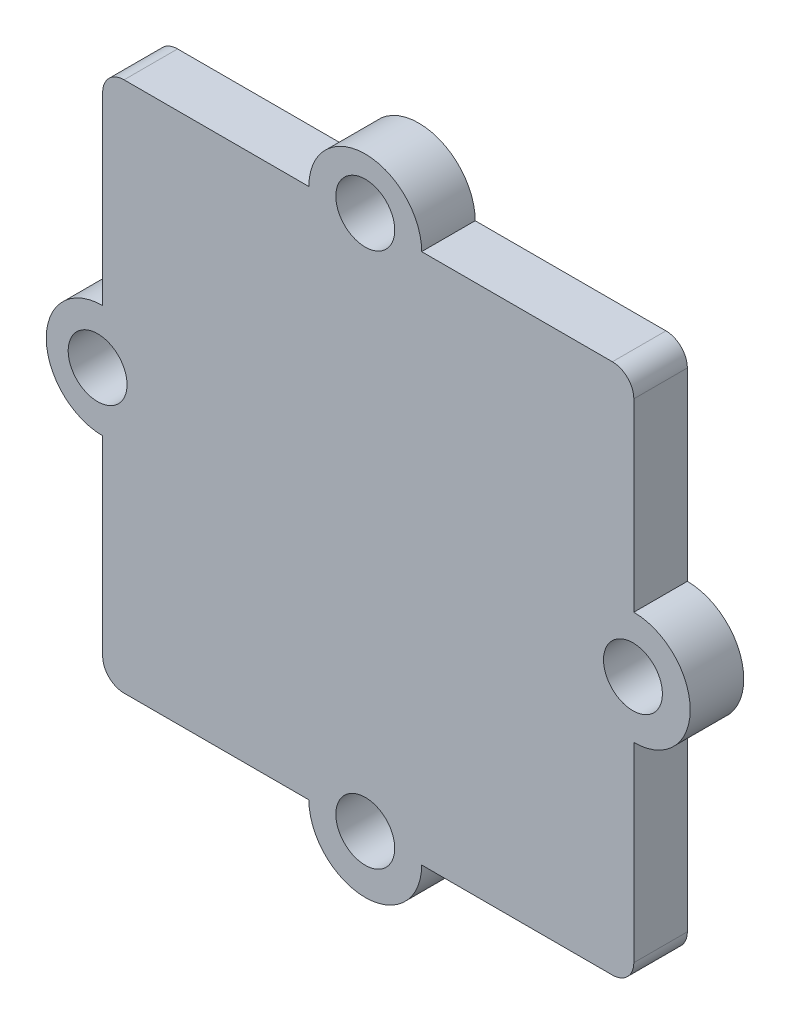
from build123d import *

# Parameters (mm, degrees)
BOSS_EXTRUDE1_DEPTH   = 2
F_1_CLEARANCE_HOLE1_D = 2.20000068
FILLET1_R             = 0.8


with BuildPart() as part:
    # Sketch1 → Boss-Extrude1 (new body)
    with BuildSketch(Plane(origin=(0, 0, -2), x_dir=(-1, 0, 0), z_dir=(0, 0, -1))):
        with BuildLine():
            Line((-1.91693771, 8.900326187), (-9.84300771, 8.900326187))
            Line((-9.84300771, 8.900326187), (-9.84300771, 1.196506187))
            ThreePointArc((-9.84300771, 1.196506187), (-11.94993771, -0.910423813), (-9.84300771, -3.017353813))
            Line((-9.84300771, -3.017353813), (-9.84300771, -10.943423813))
            Line((-9.84300771, -10.943423813), (-1.91693771, -10.943423813))
            ThreePointArc((-1.91693771, -10.943423813), (0.18999229, -13.050353813), (2.29692229, -10.943423813))
            Line((2.29692229, -10.943423813), (10.00074229, -10.943423813))
            Line((10.00074229, -10.943423813), (10.00074229, -3.017353813))
            ThreePointArc((10.00074229, -3.017353813), (12.10767229, -0.910423813), (10.00074229, 1.196506187))
            Line((10.00074229, 1.196506187), (10.00074229, 8.900326187))
            Line((10.00074229, 8.900326187), (2.29692229, 8.900326187))
            ThreePointArc((2.29692229, 8.900326187), (0.18999229, 11.007256187), (-1.91693771, 8.900326187))
        make_face()
    extrude(amount=-BOSS_EXTRUDE1_DEPTH)

    # #1 Clearance Hole1 (through all)
    with Locations(Plane(origin=(0, 0, -2), x_dir=(-1, 0, 0), z_dir=(0, 0, -1))):
        with Locations((0.189367378, -10.907429297), (0.189367378, 9.092570703), (10.189367378, -0.907429297), (-9.810632622, -0.907429297)):
            Hole(F_1_CLEARANCE_HOLE1_D / 2)

    # Fillet1
    fillet1_edges = [part.edges().sort_by_distance(p)[0] for p in [
        (-10.00074229, 8.900326187, -1),
        (-10.00074229, -10.943423813, -1),
        (9.84300771, -10.943423813, -1),
        (9.84300771, 8.900326187, -1),
    ]]
    fillet(fillet1_edges, radius=FILLET1_R)


solid = part.part
